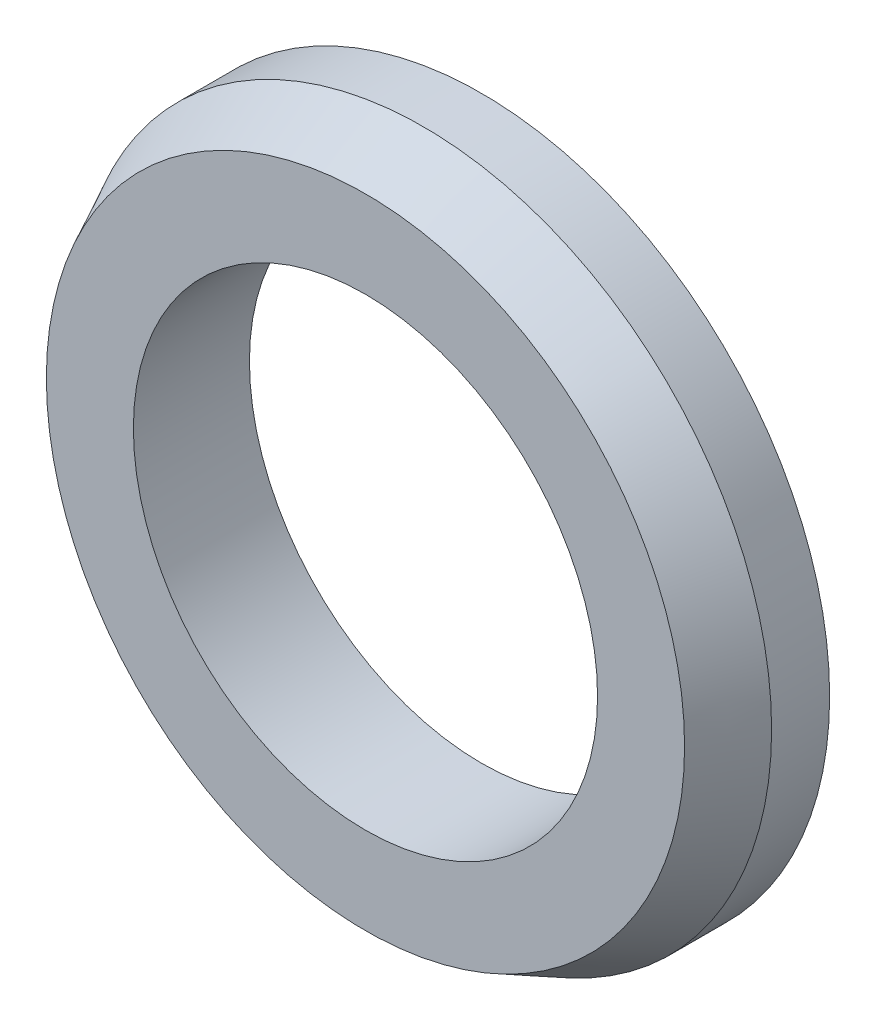
from build123d import *


with BuildPart() as part:
    # Sketch1 → Revolve1 (revolve)
    with BuildSketch(Plane(origin=(0, 0, 0), x_dir=(0, 0, -1), z_dir=(1, 0, 0)), mode=Mode.PRIVATE) as revolve1_sk:
        Polygon((0, 4), (0, 6), (-1, 6), (-2, 5.5), (-2, 4), align=None)
    revolve(revolve1_sk.sketch.rotate(Axis((0, 0, 0), (0, 0, 1)), 90), axis=Axis((0, 0, 0), (0, 0, 1)))


solid = part.part
